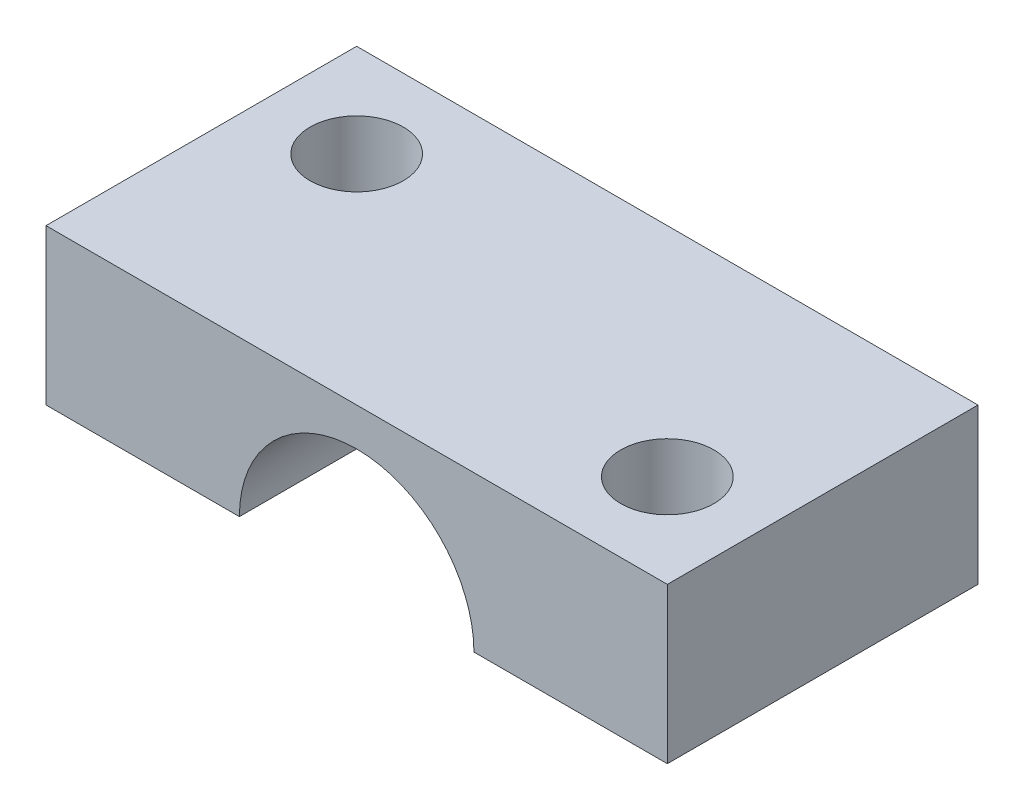
from build123d import *

# Parameters (mm, degrees)
SKETCH1_W           = 20
SKETCH1_H           = 10
BOSS_EXTRUDE1_DEPTH = 5
SKETCH2_R           = 3.775
CUT_EXTRUDE1_DEPTH  = 10
SKETCH3_R           = 1.5
CUT_EXTRUDE2_DEPTH  = 5


with BuildPart() as part:
    # Sketch1 → Boss-Extrude1 (new body)
    with BuildSketch(Plane(origin=(0, 0, 0), x_dir=(1, 0, 0), z_dir=(0, 1, 0))):
        with Locations((-15.016162702, -5.245981532)):
            Rectangle(SKETCH1_W, SKETCH1_H)
    extrude(amount=BOSS_EXTRUDE1_DEPTH)

    # Sketch2 → Cut-Extrude1 (cut)
    with BuildSketch(Plane.XY.offset(10.245981532)):
        with Locations((-15.016162702, 0)):
            Circle(SKETCH2_R)
    extrude(amount=-CUT_EXTRUDE1_DEPTH, mode=Mode.SUBTRACT)

    # Sketch3 → Cut-Extrude2 (cut)
    with BuildSketch(Plane(origin=(0, 5, 0), x_dir=(1, 0, 0), z_dir=(0, 1, 0))):
        with Locations(Location((-22.016162702, -3.245981532, 0), (0, 0, 270))):
            Circle(SKETCH3_R)
        with Locations(Location((-8.016162702, -7.245981532, 0), (0, 0, 270))):
            Circle(SKETCH3_R)
    extrude(amount=-CUT_EXTRUDE2_DEPTH, mode=Mode.SUBTRACT)


solid = part.part
